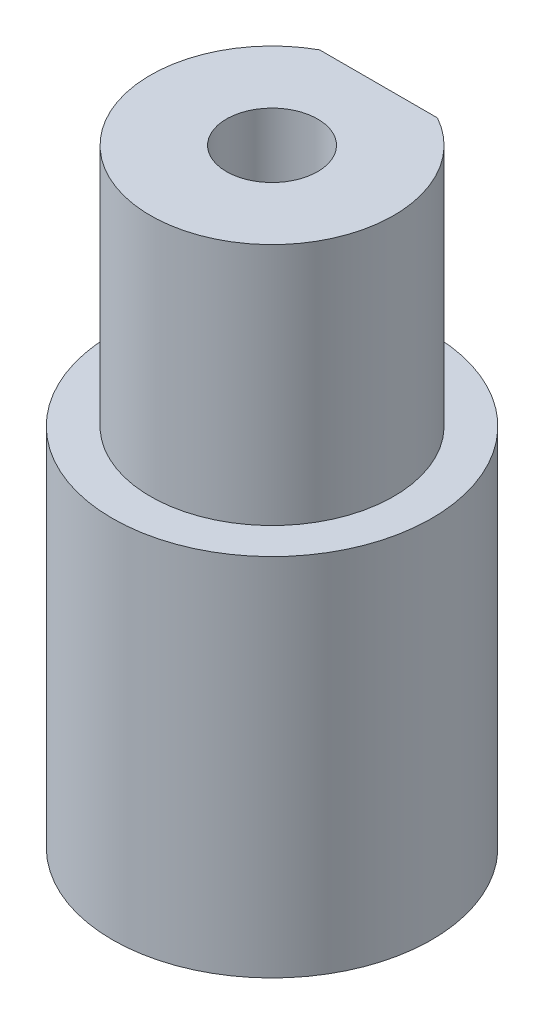
from build123d import *

# Parameters (mm, degrees)
SKETCH1_R           = 5.25
SKETCH1_R_2         = 3
BOSS_EXTRUDE1_DEPTH = 12
SKETCH2_R           = 4
SKETCH2_R_2         = 1.5
BOSS_EXTRUDE2_DEPTH = 8
CUT_EXTRUDE2_START  = -8
CUT_EXTRUDE2_DEPTH  = 8


with BuildPart() as part:
    # Sketch1 → Boss-Extrude1 (new body)
    with BuildSketch(Plane(origin=(0, 0, 0), x_dir=(1, 0, 0), z_dir=(0, 1, 0))):
        with Locations(Location((0, 0, 0), (0, 0, 270))):
            Circle(SKETCH1_R)
        with Locations(Location((0, 0, 0), (0, 0, 270))):
            Circle(SKETCH1_R_2, mode=Mode.SUBTRACT)
    extrude(amount=BOSS_EXTRUDE1_DEPTH)

    # Sketch2 → Boss-Extrude2 (add)
    with BuildSketch(Plane(origin=(0, 12, 0), x_dir=(1, 0, 0), z_dir=(0, 1, 0))):
        with Locations(Location((0, 0, 0), (0, 0, 270))):
            Circle(SKETCH2_R)
        with Locations(Location((0, 0, 0), (0, 0, 270))):
            Circle(SKETCH2_R_2, mode=Mode.SUBTRACT)
    extrude(amount=BOSS_EXTRUDE2_DEPTH)

    # Sketch4 → Cut-Extrude2 (cut)
    with BuildSketch(Plane(origin=(0, 20, 0), x_dir=(1, 0, 0), z_dir=(0, 1, 0)).offset(CUT_EXTRUDE2_START)):
        with BuildLine():
            Line((-1.936491673, 3.5), (1.936491673, 3.5))
            ThreePointArc((1.936491673, 3.5), (0, 4), (-1.936491673, 3.5))
        make_face()
    extrude(amount=CUT_EXTRUDE2_DEPTH, mode=Mode.SUBTRACT)


solid = part.part
